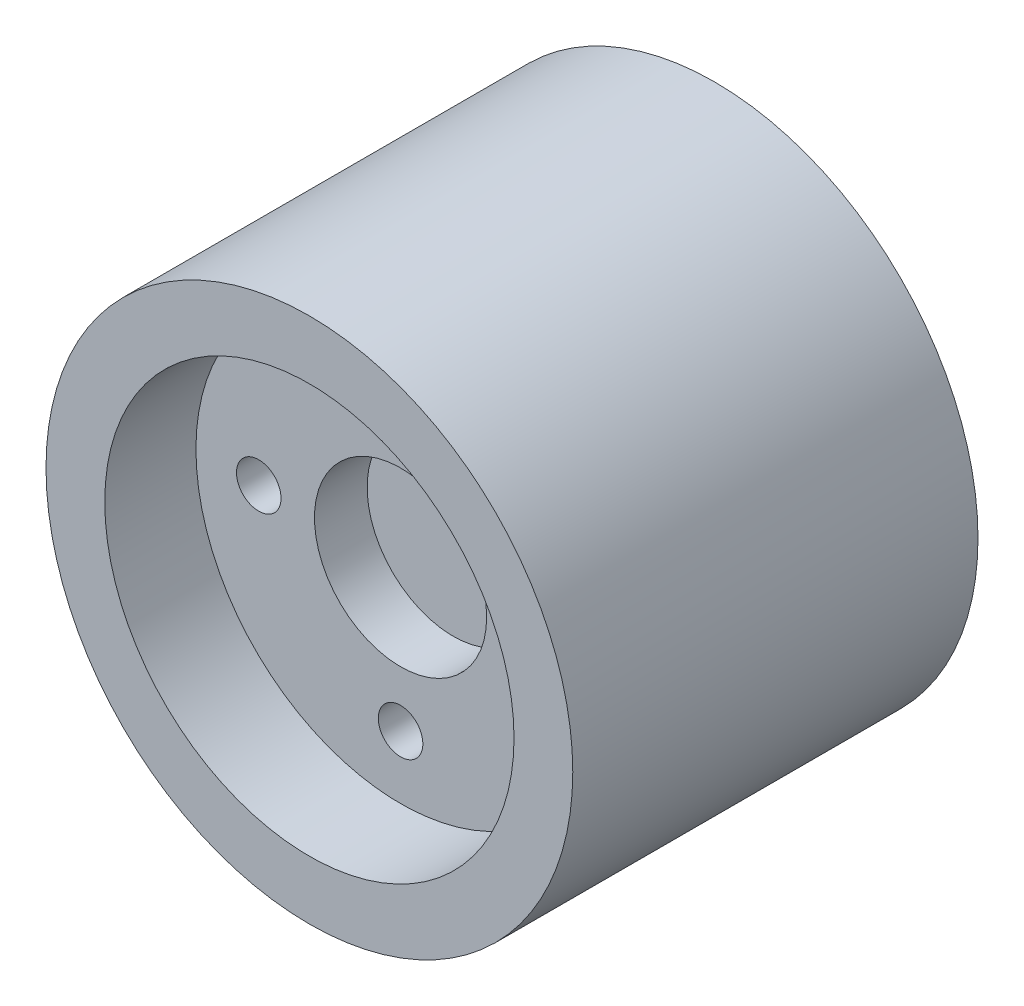
from build123d import *

# Parameters (mm, degrees)
SKETCH1_R           = 13
BOSS_EXTRUDE1_DEPTH = 20
SKETCH2_R           = 10.1
CUT_EXTRUDE1_DEPTH  = 4.5
SKETCH3_R           = 4.25
CUT_EXTRUDE2_DEPTH  = 2.6
SKETCH4_R           = 2.125
CUT_EXTRUDE3_DEPTH  = 10
SKETCH5_R           = 2
CUT_EXTRUDE4_DEPTH  = 13.5
SKETCH6_R           = 1.1
CUT_EXTRUDE5_DEPTH  = 28.166155414
SKETCH7_R           = 2
CUT_EXTRUDE6_DEPTH  = 6


with BuildPart() as part:
    # Sketch1 → Boss-Extrude1 (new body)
    with BuildSketch(Plane.XY):
        Circle(SKETCH1_R)
    extrude(amount=BOSS_EXTRUDE1_DEPTH)

    # Sketch2 → Cut-Extrude1 (cut)
    with BuildSketch(Plane.XY.offset(20)):
        Circle(SKETCH2_R)
    extrude(amount=-CUT_EXTRUDE1_DEPTH, mode=Mode.SUBTRACT)

    # Sketch3 → Cut-Extrude2 (cut)
    with BuildSketch(Plane.XY.offset(15.5)):
        Circle(SKETCH3_R)
    extrude(amount=-CUT_EXTRUDE2_DEPTH, mode=Mode.SUBTRACT)

    # Sketch4 → Cut-Extrude3 (cut)
    with BuildSketch(Plane(origin=(0, 0, 0), x_dir=(-1, 0, 0), z_dir=(0, 0, -1))):
        Circle(SKETCH4_R)
    extrude(amount=-CUT_EXTRUDE3_DEPTH, mode=Mode.SUBTRACT)

    # Sketch5 → Cut-Extrude4 (cut)
    with BuildSketch(Plane(origin=(0, 0, 0), x_dir=(-1, 0, 0), z_dir=(0, 0, -1))):
        with Locations((0, 7)):
            Circle(SKETCH5_R)
        with Locations((7, 0)):
            Circle(SKETCH5_R)
        with Locations((0, -7)):
            Circle(SKETCH5_R)
    extrude(amount=-CUT_EXTRUDE4_DEPTH, mode=Mode.SUBTRACT)

    # Sketch6 → Cut-Extrude5 (cut, through all)
    with BuildSketch(Plane(origin=(0, 0, 0), x_dir=(-1, 0, 0), z_dir=(0, 0, -1))):
        with Locations(Location((0, 7, 0), (0, 0, 180))):
            Circle(SKETCH6_R)
        with Locations(Location((7, 0, 0), (0, 0, 180))):
            Circle(SKETCH6_R)
        with Locations(Location((0, -7, 0), (0, 0, 180))):
            Circle(SKETCH6_R)
    extrude(amount=-CUT_EXTRUDE5_DEPTH, mode=Mode.SUBTRACT)

    # Sketch7 → Cut-Extrude6 (cut)
    with BuildSketch(Plane(origin=(0, 0, 0), x_dir=(-1, 0, 0), z_dir=(0, 0, -1))):
        with Locations((-6, 5)):
            Circle(SKETCH7_R)
        with Locations(Location((-6, -5, 0), (0, 0, 180))):
            Circle(SKETCH7_R)
    extrude(amount=-CUT_EXTRUDE6_DEPTH, mode=Mode.SUBTRACT)


solid = part.part
